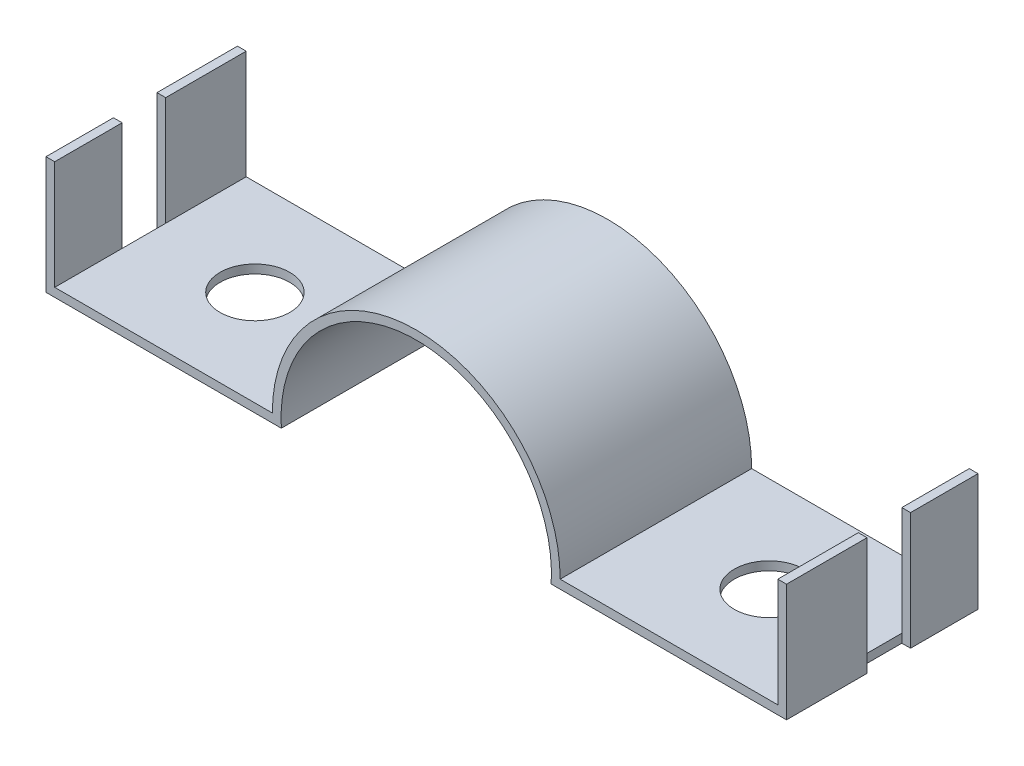
from build123d import *

# Parameters (mm, degrees)
BOSS_EXTRUDE1_DEPTH = 11.176
SKETCH2_R           = 2.032
CUT_EXTRUDE1_DEPTH  = 26.73462306
SKETCH4_W           = 2.54
SKETCH4_H           = 6.858
CUT_EXTRUDE2_DEPTH  = 0.508
SKETCH5_W           = 2.54
SKETCH5_H           = 6.858
CUT_EXTRUDE3_DEPTH  = 0.508


with BuildPart() as part:
    # Sketch1 → Boss-Extrude1 (new body)
    with BuildSketch(Plane.XY):
        with BuildLine():
            Line((8.39837008, 0), (21.09837008, 0))
            Line((21.09837008, 0), (21.09837008, 6.35))
            Line((21.09837008, 6.35), (21.60637008, 6.35))
            Line((21.60637008, 6.35), (21.60637008, -0.508))
            Line((21.60637008, -0.508), (7.874, -0.508))
            ThreePointArc((7.874, -0.508), (0, 7.89037008), (-7.874, -0.508))
            Line((-7.874, -0.508), (-21.60637008, -0.508))
            Line((-21.60637008, -0.508), (-21.60637008, 6.35))
            Line((-21.60637008, 6.35), (-21.09837008, 6.35))
            Line((-21.09837008, 6.35), (-21.09837008, 0))
            Line((-21.09837008, 0), (-8.39837008, 0))
            ThreePointArc((-8.39837008, 0), (0, 8.39837008), (8.39837008, 0))
        make_face()
    extrude(amount=BOSS_EXTRUDE1_DEPTH)

    # Sketch2 → Cut-Extrude1 (cut, through all)
    with BuildSketch(Plane(origin=(0, 0, 0), x_dir=(1, 0, 0), z_dir=(0, 1, 0))):
        with Locations(Location((15.00237008, -5.588, 0), (0, 0, 270))):
            Circle(SKETCH2_R)
        with Locations(Location((-15.00237008, -5.588, 0), (0, 0, 90))):
            Circle(SKETCH2_R)
    extrude(amount=-CUT_EXTRUDE1_DEPTH, mode=Mode.SUBTRACT)

    # Sketch4 → Cut-Extrude2 (cut)
    with BuildSketch(Plane(origin=(21.60637008, 0, 0), x_dir=(0, 0, -1), z_dir=(1, 0, 0))):
        with Locations((-5.207, 2.921)):
            Rectangle(SKETCH4_W, SKETCH4_H)
    extrude(amount=-CUT_EXTRUDE2_DEPTH, mode=Mode.SUBTRACT)

    # Sketch5 → Cut-Extrude3 (cut)
    with BuildSketch(Plane.ZY.offset(21.60637008)):
        with Locations((5.969, 2.921)):
            Rectangle(SKETCH5_W, SKETCH5_H)
    extrude(amount=-CUT_EXTRUDE3_DEPTH, mode=Mode.SUBTRACT)


solid = part.part
